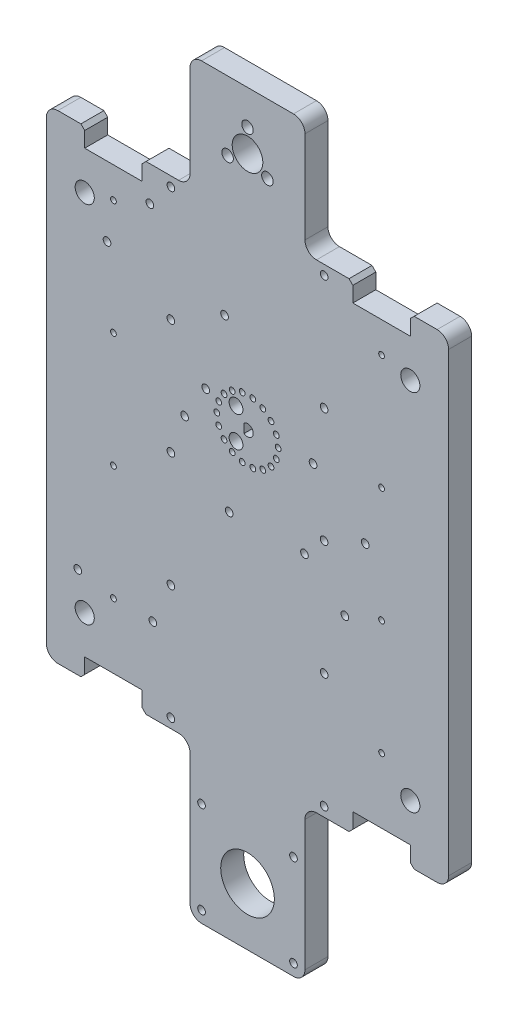
from build123d import *

# Parameters (mm, degrees)
SKETCH_1_W          = 105
SKETCH_1_H          = 125
EXTRUDE_1_DEPTH     = 6
CUT_EXTRUDE_1_REACH = 165.359
SKETCH_2_R          = 1
SKETCH_2_R_2        = 0.75
FILLET_1_R          = 3
CUT_EXTRUDE_2_REACH = 165.359
SKETCH_3_R          = 0.75
SKETCH_3_R_2        = 1.8
CUT_EXTRUDE1_REACH  = 165.359
SKETCH2_R           = 1
BOSS_EXTRUDE1_DEPTH = 6
CUT_EXTRUDE2_REACH  = 197.668
SKETCH5_R           = 4
SKETCH5_R_2         = 1.5
FILLET1_R           = 3
CUT_EXTRUDE3_REACH  = 197.668
SKETCH6_R           = 2.5
CUT_EXTRUDE4_REACH  = 197.668
SKETCH8_R           = 1
SKETCH8_R_2         = 7
FILLET2_R           = 3
SKETCH9_W           = 15
SKETCH9_H           = 6
CUT_EXTRUDE5_DEPTH  = 5
SKETCH10_W          = 15
SKETCH10_H          = 6
CUT_EXTRUDE6_DEPTH  = 5
CHAMFER1_SIZE       = 1


with BuildPart() as part:
    # 草图1 → 凸台-拉伸1 (new body)
    with BuildSketch(Plane.XY):
        with Locations((52.5, -62.5)):
            Rectangle(SKETCH_1_W, SKETCH_1_H)
    extrude(amount=EXTRUDE_1_DEPTH)

    # 草图2 → 切除-拉伸1 (cut, up to next)
    with BuildSketch(Plane.XY.offset(6), mode=Mode.PRIVATE) as cut_extrude_1_sk1:
        with Locations((32.5, -2.5)):
            Circle(SKETCH_2_R)
    cut_extrude_1_tool1 = extrude(cut_extrude_1_sk1.sketch, amount=-CUT_EXTRUDE_1_REACH, mode=Mode.PRIVATE) & part.part
    # 草图2 → 切除-拉伸1 (cut, up to next)
    with BuildSketch(Plane.XY.offset(6), mode=Mode.PRIVATE) as cut_extrude_1_sk2:
        with Locations((72.5, -2.5)):
            Circle(SKETCH_2_R)
    cut_extrude_1_tool2 = extrude(cut_extrude_1_sk2.sketch, amount=-CUT_EXTRUDE_1_REACH, mode=Mode.PRIVATE) & part.part
    # 草图2 → 切除-拉伸1 (cut, up to next)
    with BuildSketch(Plane.XY.offset(6), mode=Mode.PRIVATE) as cut_extrude_1_sk3:
        with Locations((72.5, -32.5)):
            Circle(SKETCH_2_R)
    cut_extrude_1_tool3 = extrude(cut_extrude_1_sk3.sketch, amount=-CUT_EXTRUDE_1_REACH, mode=Mode.PRIVATE) & part.part
    # 草图2 → 切除-拉伸1 (cut, up to next)
    with BuildSketch(Plane.XY.offset(6), mode=Mode.PRIVATE) as cut_extrude_1_sk4:
        with Locations((72.5, -62.5)):
            Circle(SKETCH_2_R)
    cut_extrude_1_tool4 = extrude(cut_extrude_1_sk4.sketch, amount=-CUT_EXTRUDE_1_REACH, mode=Mode.PRIVATE) & part.part
    # 草图2 → 切除-拉伸1 (cut, up to next)
    with BuildSketch(Plane.XY.offset(6), mode=Mode.PRIVATE) as cut_extrude_1_sk5:
        with Locations((72.5, -92.5)):
            Circle(SKETCH_2_R)
    cut_extrude_1_tool5 = extrude(cut_extrude_1_sk5.sketch, amount=-CUT_EXTRUDE_1_REACH, mode=Mode.PRIVATE) & part.part
    # 草图2 → 切除-拉伸1 (cut, up to next)
    with BuildSketch(Plane.XY.offset(6), mode=Mode.PRIVATE) as cut_extrude_1_sk6:
        with Locations((72.5, -122.5)):
            Circle(SKETCH_2_R)
    cut_extrude_1_tool6 = extrude(cut_extrude_1_sk6.sketch, amount=-CUT_EXTRUDE_1_REACH, mode=Mode.PRIVATE) & part.part
    # 草图2 → 切除-拉伸1 (cut, up to next)
    with BuildSketch(Plane.XY.offset(6), mode=Mode.PRIVATE) as cut_extrude_1_sk7:
        with Locations((32.5, -32.5)):
            Circle(SKETCH_2_R)
    cut_extrude_1_tool7 = extrude(cut_extrude_1_sk7.sketch, amount=-CUT_EXTRUDE_1_REACH, mode=Mode.PRIVATE) & part.part
    # 草图2 → 切除-拉伸1 (cut, up to next)
    with BuildSketch(Plane.XY.offset(6), mode=Mode.PRIVATE) as cut_extrude_1_sk8:
        with Locations((32.5, -62.5)):
            Circle(SKETCH_2_R)
    cut_extrude_1_tool8 = extrude(cut_extrude_1_sk8.sketch, amount=-CUT_EXTRUDE_1_REACH, mode=Mode.PRIVATE) & part.part
    # 草图2 → 切除-拉伸1 (cut, up to next)
    with BuildSketch(Plane.XY.offset(6), mode=Mode.PRIVATE) as cut_extrude_1_sk9:
        with Locations((32.5, -92.5)):
            Circle(SKETCH_2_R)
    cut_extrude_1_tool9 = extrude(cut_extrude_1_sk9.sketch, amount=-CUT_EXTRUDE_1_REACH, mode=Mode.PRIVATE) & part.part
    # 草图2 → 切除-拉伸1 (cut, up to next)
    with BuildSketch(Plane.XY.offset(6), mode=Mode.PRIVATE) as cut_extrude_1_sk10:
        with Locations((32.5, -122.5)):
            Circle(SKETCH_2_R)
    cut_extrude_1_tool10 = extrude(cut_extrude_1_sk10.sketch, amount=-CUT_EXTRUDE_1_REACH, mode=Mode.PRIVATE) & part.part
    # 草图2 → 切除-拉伸1 (cut, up to next)
    with BuildSketch(Plane.XY.offset(6), mode=Mode.PRIVATE) as cut_extrude_1_sk11:
        with Locations((17.5, -13)):
            Circle(SKETCH_2_R_2)
    cut_extrude_1_tool11 = extrude(cut_extrude_1_sk11.sketch, amount=-CUT_EXTRUDE_1_REACH, mode=Mode.PRIVATE) & part.part
    # 草图2 → 切除-拉伸1 (cut, up to next)
    with BuildSketch(Plane.XY.offset(6), mode=Mode.PRIVATE) as cut_extrude_1_sk12:
        with Locations((87.5, -13)):
            Circle(SKETCH_2_R_2)
    cut_extrude_1_tool12 = extrude(cut_extrude_1_sk12.sketch, amount=-CUT_EXTRUDE_1_REACH, mode=Mode.PRIVATE) & part.part
    # 草图2 → 切除-拉伸1 (cut, up to next)
    with BuildSketch(Plane.XY.offset(6), mode=Mode.PRIVATE) as cut_extrude_1_sk13:
        with Locations((87.5, -43)):
            Circle(SKETCH_2_R_2)
    cut_extrude_1_tool13 = extrude(cut_extrude_1_sk13.sketch, amount=-CUT_EXTRUDE_1_REACH, mode=Mode.PRIVATE) & part.part
    # 草图2 → 切除-拉伸1 (cut, up to next)
    with BuildSketch(Plane.XY.offset(6), mode=Mode.PRIVATE) as cut_extrude_1_sk14:
        with Locations((87.5, -73)):
            Circle(SKETCH_2_R_2)
    cut_extrude_1_tool14 = extrude(cut_extrude_1_sk14.sketch, amount=-CUT_EXTRUDE_1_REACH, mode=Mode.PRIVATE) & part.part
    # 草图2 → 切除-拉伸1 (cut, up to next)
    with BuildSketch(Plane.XY.offset(6), mode=Mode.PRIVATE) as cut_extrude_1_sk15:
        with Locations((87.5, -103)):
            Circle(SKETCH_2_R_2)
    cut_extrude_1_tool15 = extrude(cut_extrude_1_sk15.sketch, amount=-CUT_EXTRUDE_1_REACH, mode=Mode.PRIVATE) & part.part
    # 草图2 → 切除-拉伸1 (cut, up to next)
    with BuildSketch(Plane.XY.offset(6), mode=Mode.PRIVATE) as cut_extrude_1_sk16:
        with Locations((17.5, -43)):
            Circle(SKETCH_2_R_2)
    cut_extrude_1_tool16 = extrude(cut_extrude_1_sk16.sketch, amount=-CUT_EXTRUDE_1_REACH, mode=Mode.PRIVATE) & part.part
    # 草图2 → 切除-拉伸1 (cut, up to next)
    with BuildSketch(Plane.XY.offset(6), mode=Mode.PRIVATE) as cut_extrude_1_sk17:
        with Locations((17.5, -73)):
            Circle(SKETCH_2_R_2)
    cut_extrude_1_tool17 = extrude(cut_extrude_1_sk17.sketch, amount=-CUT_EXTRUDE_1_REACH, mode=Mode.PRIVATE) & part.part
    # 草图2 → 切除-拉伸1 (cut, up to next)
    with BuildSketch(Plane.XY.offset(6), mode=Mode.PRIVATE) as cut_extrude_1_sk18:
        with Locations((17.5, -103)):
            Circle(SKETCH_2_R_2)
    cut_extrude_1_tool18 = extrude(cut_extrude_1_sk18.sketch, amount=-CUT_EXTRUDE_1_REACH, mode=Mode.PRIVATE) & part.part
    add(cut_extrude_1_tool1.solids().sort_by_distance((32.5, -2.5, 6))[0], mode=Mode.SUBTRACT)
    add(cut_extrude_1_tool2.solids().sort_by_distance((72.5, -2.5, 6))[0], mode=Mode.SUBTRACT)
    add(cut_extrude_1_tool3.solids().sort_by_distance((72.5, -32.5, 6))[0], mode=Mode.SUBTRACT)
    add(cut_extrude_1_tool4.solids().sort_by_distance((72.5, -62.5, 6))[0], mode=Mode.SUBTRACT)
    add(cut_extrude_1_tool5.solids().sort_by_distance((72.5, -92.5, 6))[0], mode=Mode.SUBTRACT)
    add(cut_extrude_1_tool6.solids().sort_by_distance((72.5, -122.5, 6))[0], mode=Mode.SUBTRACT)
    add(cut_extrude_1_tool7.solids().sort_by_distance((32.5, -32.5, 6))[0], mode=Mode.SUBTRACT)
    add(cut_extrude_1_tool8.solids().sort_by_distance((32.5, -62.5, 6))[0], mode=Mode.SUBTRACT)
    add(cut_extrude_1_tool9.solids().sort_by_distance((32.5, -92.5, 6))[0], mode=Mode.SUBTRACT)
    add(cut_extrude_1_tool10.solids().sort_by_distance((32.5, -122.5, 6))[0], mode=Mode.SUBTRACT)
    add(cut_extrude_1_tool11.solids().sort_by_distance((17.5, -13, 6))[0], mode=Mode.SUBTRACT)
    add(cut_extrude_1_tool12.solids().sort_by_distance((87.5, -13, 6))[0], mode=Mode.SUBTRACT)
    add(cut_extrude_1_tool13.solids().sort_by_distance((87.5, -43, 6))[0], mode=Mode.SUBTRACT)
    add(cut_extrude_1_tool14.solids().sort_by_distance((87.5, -73, 6))[0], mode=Mode.SUBTRACT)
    add(cut_extrude_1_tool15.solids().sort_by_distance((87.5, -103, 6))[0], mode=Mode.SUBTRACT)
    add(cut_extrude_1_tool16.solids().sort_by_distance((17.5, -43, 6))[0], mode=Mode.SUBTRACT)
    add(cut_extrude_1_tool17.solids().sort_by_distance((17.5, -73, 6))[0], mode=Mode.SUBTRACT)
    add(cut_extrude_1_tool18.solids().sort_by_distance((17.5, -103, 6))[0], mode=Mode.SUBTRACT)

    # 圆角1
    fillet_1_edges = [part.edges().sort_by_distance(p)[0] for p in [
        (0, 0, 3),
        (105, 0, 3),
        (105, -125, 3),
        (0, -125, 3),
    ]]
    fillet(fillet_1_edges, radius=FILLET_1_R)

    # 草图3 → 切除-拉伸2 (cut, up to next)
    with BuildSketch(Plane.XY.offset(6), mode=Mode.PRIVATE) as cut_extrude_2_sk1:
        with Locations((44.5, -47.5)):
            Circle(SKETCH_3_R)
    cut_extrude_2_tool1 = extrude(cut_extrude_2_sk1.sketch, amount=-CUT_EXTRUDE_2_REACH, mode=Mode.PRIVATE) & part.part
    # 草图3 → 切除-拉伸2 (cut, up to next)
    with BuildSketch(Plane.XY.offset(6), mode=Mode.PRIVATE) as cut_extrude_2_sk2:
        with Locations((44.982459034, -44.763838853)):
            Circle(SKETCH_3_R)
    cut_extrude_2_tool2 = extrude(cut_extrude_2_sk2.sketch, amount=-CUT_EXTRUDE_2_REACH, mode=Mode.PRIVATE) & part.part
    # 草图3 → 切除-拉伸2 (cut, up to next)
    with BuildSketch(Plane.XY.offset(6), mode=Mode.PRIVATE) as cut_extrude_2_sk3:
        with Locations((49.5, -43.5)):
            Circle(SKETCH_3_R_2)
    cut_extrude_2_tool3 = extrude(cut_extrude_2_sk3.sketch, amount=-CUT_EXTRUDE_2_REACH, mode=Mode.PRIVATE) & part.part
    # 草图3 → 切除-拉伸2 (cut, up to next)
    with BuildSketch(Plane.XY.offset(6), mode=Mode.PRIVATE) as cut_extrude_2_sk4:
        with Locations((49.5, -51.5)):
            Circle(SKETCH_3_R_2)
    cut_extrude_2_tool4 = extrude(cut_extrude_2_sk4.sketch, amount=-CUT_EXTRUDE_2_REACH, mode=Mode.PRIVATE) & part.part
    # 草图3 → 切除-拉伸2 (cut, up to next)
    with BuildSketch(Plane.XY.offset(6), mode=Mode.PRIVATE) as cut_extrude_2_sk5:
        with Locations((46.371644455, -42.357699123)):
            Circle(SKETCH_3_R)
    cut_extrude_2_tool5 = extrude(cut_extrude_2_sk5.sketch, amount=-CUT_EXTRUDE_2_REACH, mode=Mode.PRIVATE) & part.part
    # 草图3 → 切除-拉伸2 (cut, up to next)
    with BuildSketch(Plane.XY.offset(6), mode=Mode.PRIVATE) as cut_extrude_2_sk6:
        with Locations((48.5, -40.57179677)):
            Circle(SKETCH_3_R)
    cut_extrude_2_tool6 = extrude(cut_extrude_2_sk6.sketch, amount=-CUT_EXTRUDE_2_REACH, mode=Mode.PRIVATE) & part.part
    # 草图3 → 切除-拉伸2 (cut, up to next)
    with BuildSketch(Plane.XY.offset(6), mode=Mode.PRIVATE) as cut_extrude_2_sk7:
        with Locations((51.110814579, -39.621537976)):
            Circle(SKETCH_3_R)
    cut_extrude_2_tool7 = extrude(cut_extrude_2_sk7.sketch, amount=-CUT_EXTRUDE_2_REACH, mode=Mode.PRIVATE) & part.part
    # 草图3 → 切除-拉伸2 (cut, up to next)
    with BuildSketch(Plane.XY.offset(6), mode=Mode.PRIVATE) as cut_extrude_2_sk8:
        with Locations((53.889185421, -39.621537976)):
            Circle(SKETCH_3_R)
    cut_extrude_2_tool8 = extrude(cut_extrude_2_sk8.sketch, amount=-CUT_EXTRUDE_2_REACH, mode=Mode.PRIVATE) & part.part
    # 草图3 → 切除-拉伸2 (cut, up to next)
    with BuildSketch(Plane.XY.offset(6), mode=Mode.PRIVATE) as cut_extrude_2_sk9:
        with Locations((56.5, -40.57179677)):
            Circle(SKETCH_3_R)
    cut_extrude_2_tool9 = extrude(cut_extrude_2_sk9.sketch, amount=-CUT_EXTRUDE_2_REACH, mode=Mode.PRIVATE) & part.part
    # 草图3 → 切除-拉伸2 (cut, up to next)
    with BuildSketch(Plane.XY.offset(6), mode=Mode.PRIVATE) as cut_extrude_2_sk10:
        with Locations((58.628355545, -42.357699123)):
            Circle(SKETCH_3_R)
    cut_extrude_2_tool10 = extrude(cut_extrude_2_sk10.sketch, amount=-CUT_EXTRUDE_2_REACH, mode=Mode.PRIVATE) & part.part
    # 草图3 → 切除-拉伸2 (cut, up to next)
    with BuildSketch(Plane.XY.offset(6), mode=Mode.PRIVATE) as cut_extrude_2_sk11:
        with Locations((60.017540966, -44.763838853)):
            Circle(SKETCH_3_R)
    cut_extrude_2_tool11 = extrude(cut_extrude_2_sk11.sketch, amount=-CUT_EXTRUDE_2_REACH, mode=Mode.PRIVATE) & part.part
    # 草图3 → 切除-拉伸2 (cut, up to next)
    with BuildSketch(Plane.XY.offset(6), mode=Mode.PRIVATE) as cut_extrude_2_sk12:
        with Locations((60.5, -47.5)):
            Circle(SKETCH_3_R)
    cut_extrude_2_tool12 = extrude(cut_extrude_2_sk12.sketch, amount=-CUT_EXTRUDE_2_REACH, mode=Mode.PRIVATE) & part.part
    # 草图3 → 切除-拉伸2 (cut, up to next)
    with BuildSketch(Plane.XY.offset(6), mode=Mode.PRIVATE) as cut_extrude_2_sk13:
        with Locations((60.017540966, -50.236161147)):
            Circle(SKETCH_3_R)
    cut_extrude_2_tool13 = extrude(cut_extrude_2_sk13.sketch, amount=-CUT_EXTRUDE_2_REACH, mode=Mode.PRIVATE) & part.part
    # 草图3 → 切除-拉伸2 (cut, up to next)
    with BuildSketch(Plane.XY.offset(6), mode=Mode.PRIVATE) as cut_extrude_2_sk14:
        with Locations((58.628355545, -52.642300877)):
            Circle(SKETCH_3_R)
    cut_extrude_2_tool14 = extrude(cut_extrude_2_sk14.sketch, amount=-CUT_EXTRUDE_2_REACH, mode=Mode.PRIVATE) & part.part
    # 草图3 → 切除-拉伸2 (cut, up to next)
    with BuildSketch(Plane.XY.offset(6), mode=Mode.PRIVATE) as cut_extrude_2_sk15:
        with Locations((56.5, -54.42820323)):
            Circle(SKETCH_3_R)
    cut_extrude_2_tool15 = extrude(cut_extrude_2_sk15.sketch, amount=-CUT_EXTRUDE_2_REACH, mode=Mode.PRIVATE) & part.part
    # 草图3 → 切除-拉伸2 (cut, up to next)
    with BuildSketch(Plane.XY.offset(6), mode=Mode.PRIVATE) as cut_extrude_2_sk16:
        with Locations((53.889185421, -55.378462024)):
            Circle(SKETCH_3_R)
    cut_extrude_2_tool16 = extrude(cut_extrude_2_sk16.sketch, amount=-CUT_EXTRUDE_2_REACH, mode=Mode.PRIVATE) & part.part
    # 草图3 → 切除-拉伸2 (cut, up to next)
    with BuildSketch(Plane.XY.offset(6), mode=Mode.PRIVATE) as cut_extrude_2_sk17:
        with Locations((51.110814579, -55.378462024)):
            Circle(SKETCH_3_R)
    cut_extrude_2_tool17 = extrude(cut_extrude_2_sk17.sketch, amount=-CUT_EXTRUDE_2_REACH, mode=Mode.PRIVATE) & part.part
    # 草图3 → 切除-拉伸2 (cut, up to next)
    with BuildSketch(Plane.XY.offset(6), mode=Mode.PRIVATE) as cut_extrude_2_sk18:
        with Locations((48.5, -54.42820323)):
            Circle(SKETCH_3_R)
    cut_extrude_2_tool18 = extrude(cut_extrude_2_sk18.sketch, amount=-CUT_EXTRUDE_2_REACH, mode=Mode.PRIVATE) & part.part
    # 草图3 → 切除-拉伸2 (cut, up to next)
    with BuildSketch(Plane.XY.offset(6), mode=Mode.PRIVATE) as cut_extrude_2_sk19:
        with Locations((46.371644455, -52.642300877)):
            Circle(SKETCH_3_R)
    cut_extrude_2_tool19 = extrude(cut_extrude_2_sk19.sketch, amount=-CUT_EXTRUDE_2_REACH, mode=Mode.PRIVATE) & part.part
    # 草图3 → 切除-拉伸2 (cut, up to next)
    with BuildSketch(Plane.XY.offset(6), mode=Mode.PRIVATE) as cut_extrude_2_sk20:
        with Locations((44.982459034, -50.236161147)):
            Circle(SKETCH_3_R)
    cut_extrude_2_tool20 = extrude(cut_extrude_2_sk20.sketch, amount=-CUT_EXTRUDE_2_REACH, mode=Mode.PRIVATE) & part.part
    # 草图3 → 切除-拉伸2 (cut, up to next)
    with BuildSketch(Plane.XY.offset(6), mode=Mode.PRIVATE) as cut_extrude_2_sk21:
        with BuildLine():
            Line((51.6, -46.3), (51.6, -48.7))
            ThreePointArc((51.6, -48.7), (54, -47.5), (51.6, -46.3))
        make_face()
    cut_extrude_2_tool21 = extrude(cut_extrude_2_sk21.sketch, amount=-CUT_EXTRUDE_2_REACH, mode=Mode.PRIVATE) & part.part
    add(cut_extrude_2_tool1.solids().sort_by_distance((44.5, -47.5, 6))[0], mode=Mode.SUBTRACT)
    add(cut_extrude_2_tool2.solids().sort_by_distance((44.982459, -44.763839, 6))[0], mode=Mode.SUBTRACT)
    add(cut_extrude_2_tool3.solids().sort_by_distance((49.5, -43.5, 6))[0], mode=Mode.SUBTRACT)
    add(cut_extrude_2_tool4.solids().sort_by_distance((49.5, -51.5, 6))[0], mode=Mode.SUBTRACT)
    add(cut_extrude_2_tool5.solids().sort_by_distance((46.371644, -42.357699, 6))[0], mode=Mode.SUBTRACT)
    add(cut_extrude_2_tool6.solids().sort_by_distance((48.5, -40.571797, 6))[0], mode=Mode.SUBTRACT)
    add(cut_extrude_2_tool7.solids().sort_by_distance((51.110815, -39.621538, 6))[0], mode=Mode.SUBTRACT)
    add(cut_extrude_2_tool8.solids().sort_by_distance((53.889185, -39.621538, 6))[0], mode=Mode.SUBTRACT)
    add(cut_extrude_2_tool9.solids().sort_by_distance((56.5, -40.571797, 6))[0], mode=Mode.SUBTRACT)
    add(cut_extrude_2_tool10.solids().sort_by_distance((58.628356, -42.357699, 6))[0], mode=Mode.SUBTRACT)
    add(cut_extrude_2_tool11.solids().sort_by_distance((60.017541, -44.763839, 6))[0], mode=Mode.SUBTRACT)
    add(cut_extrude_2_tool12.solids().sort_by_distance((60.5, -47.5, 6))[0], mode=Mode.SUBTRACT)
    add(cut_extrude_2_tool13.solids().sort_by_distance((60.017541, -50.236161, 6))[0], mode=Mode.SUBTRACT)
    add(cut_extrude_2_tool14.solids().sort_by_distance((58.628356, -52.642301, 6))[0], mode=Mode.SUBTRACT)
    add(cut_extrude_2_tool15.solids().sort_by_distance((56.5, -54.428203, 6))[0], mode=Mode.SUBTRACT)
    add(cut_extrude_2_tool16.solids().sort_by_distance((53.889185, -55.378462, 6))[0], mode=Mode.SUBTRACT)
    add(cut_extrude_2_tool17.solids().sort_by_distance((51.110815, -55.378462, 6))[0], mode=Mode.SUBTRACT)
    add(cut_extrude_2_tool18.solids().sort_by_distance((48.5, -54.428203, 6))[0], mode=Mode.SUBTRACT)
    add(cut_extrude_2_tool19.solids().sort_by_distance((46.371644, -52.642301, 6))[0], mode=Mode.SUBTRACT)
    add(cut_extrude_2_tool20.solids().sort_by_distance((44.982459, -50.236161, 6))[0], mode=Mode.SUBTRACT)
    add(cut_extrude_2_tool21.solids().sort_by_distance((52.690031, -47.5, 6))[0], mode=Mode.SUBTRACT)

    # Sketch2 → Cut-Extrude1 (cut, up to next)
    with BuildSketch(Plane(origin=(0, 0, 0), x_dir=(-1, 0, 0), z_dir=(0, 0, -1)), mode=Mode.PRIVATE) as cut_extrude1_sk1:
        with Locations((-27.007493333, -9.049358214)):
            Circle(SKETCH2_R)
    cut_extrude1_tool1 = extrude(cut_extrude1_sk1.sketch, amount=-CUT_EXTRUDE1_REACH, mode=Mode.PRIVATE) & part.part
    # Sketch2 → Cut-Extrude1 (cut, up to next)
    with BuildSketch(Plane(origin=(0, 0, 0), x_dir=(-1, 0, 0), z_dir=(0, 0, -1)), mode=Mode.PRIVATE) as cut_extrude1_sk2:
        with Locations((-15.831491831, -23.159531509)):
            Circle(SKETCH2_R)
    cut_extrude1_tool2 = extrude(cut_extrude1_sk2.sketch, amount=-CUT_EXTRUDE1_REACH, mode=Mode.PRIVATE) & part.part
    # Sketch2 → Cut-Extrude1 (cut, up to next)
    with BuildSketch(Plane(origin=(0, 0, 0), x_dir=(-1, 0, 0), z_dir=(0, 0, -1)), mode=Mode.PRIVATE) as cut_extrude1_sk3:
        with Locations((-41.603321246, -43.572179762)):
            Circle(SKETCH2_R)
    cut_extrude1_tool3 = extrude(cut_extrude1_sk3.sketch, amount=-CUT_EXTRUDE1_REACH, mode=Mode.PRIVATE) & part.part
    # Sketch2 → Cut-Extrude1 (cut, up to next)
    with BuildSketch(Plane(origin=(0, 0, 0), x_dir=(-1, 0, 0), z_dir=(0, 0, -1)), mode=Mode.PRIVATE) as cut_extrude1_sk4:
        with Locations((-27.794694634, -103.138789015)):
            Circle(SKETCH2_R)
    cut_extrude1_tool4 = extrude(cut_extrude1_sk4.sketch, amount=-CUT_EXTRUDE1_REACH, mode=Mode.PRIVATE) & part.part
    # Sketch2 → Cut-Extrude1 (cut, up to next)
    with BuildSketch(Plane(origin=(0, 0, 0), x_dir=(-1, 0, 0), z_dir=(0, 0, -1)), mode=Mode.PRIVATE) as cut_extrude1_sk5:
        with Locations((-36.076949821, -52.503511863)):
            Circle(SKETCH2_R)
    cut_extrude1_tool5 = extrude(cut_extrude1_sk5.sketch, amount=-CUT_EXTRUDE1_REACH, mode=Mode.PRIVATE) & part.part
    # Sketch2 → Cut-Extrude1 (cut, up to next)
    with BuildSketch(Plane(origin=(0, 0, 0), x_dir=(-1, 0, 0), z_dir=(0, 0, -1)), mode=Mode.PRIVATE) as cut_extrude1_sk6:
        with Locations((-77.908324015, -76.741624219)):
            Circle(SKETCH2_R)
    cut_extrude1_tool6 = extrude(cut_extrude1_sk6.sketch, amount=-CUT_EXTRUDE1_REACH, mode=Mode.PRIVATE) & part.part
    # Sketch2 → Cut-Extrude1 (cut, up to next)
    with BuildSketch(Plane(origin=(0, 0, 0), x_dir=(-1, 0, 0), z_dir=(0, 0, -1)), mode=Mode.PRIVATE) as cut_extrude1_sk7:
        with Locations((-69.609216951, -46.494536927)):
            Circle(SKETCH2_R)
    cut_extrude1_tool7 = extrude(cut_extrude1_sk7.sketch, amount=-CUT_EXTRUDE1_REACH, mode=Mode.PRIVATE) & part.part
    # Sketch2 → Cut-Extrude1 (cut, up to next)
    with BuildSketch(Plane(origin=(0, 0, 0), x_dir=(-1, 0, 0), z_dir=(0, 0, -1)), mode=Mode.PRIVATE) as cut_extrude1_sk8:
        with Locations((-46.508134617, -24.494894688)):
            Circle(SKETCH2_R)
    cut_extrude1_tool8 = extrude(cut_extrude1_sk8.sketch, amount=-CUT_EXTRUDE1_REACH, mode=Mode.PRIVATE) & part.part
    # Sketch2 → Cut-Extrude1 (cut, up to next)
    with BuildSketch(Plane(origin=(0, 0, 0), x_dir=(-1, 0, 0), z_dir=(0, 0, -1)), mode=Mode.PRIVATE) as cut_extrude1_sk9:
        with Locations((-8.200070919, -101.126148596)):
            Circle(SKETCH2_R)
    cut_extrude1_tool9 = extrude(cut_extrude1_sk9.sketch, amount=-CUT_EXTRUDE1_REACH, mode=Mode.PRIVATE) & part.part
    # Sketch2 → Cut-Extrude1 (cut, up to next)
    with BuildSketch(Plane(origin=(0, 0, 0), x_dir=(-1, 0, 0), z_dir=(0, 0, -1)), mode=Mode.PRIVATE) as cut_extrude1_sk10:
        with Locations((-47.713449113, -68.396651396)):
            Circle(SKETCH2_R)
    cut_extrude1_tool10 = extrude(cut_extrude1_sk10.sketch, amount=-CUT_EXTRUDE1_REACH, mode=Mode.PRIVATE) & part.part
    # Sketch2 → Cut-Extrude1 (cut, up to next)
    with BuildSketch(Plane(origin=(0, 0, 0), x_dir=(-1, 0, 0), z_dir=(0, 0, -1)), mode=Mode.PRIVATE) as cut_extrude1_sk11:
        with Locations((-67.368562658, -68.01149462)):
            Circle(SKETCH2_R)
    cut_extrude1_tool11 = extrude(cut_extrude1_sk11.sketch, amount=-CUT_EXTRUDE1_REACH, mode=Mode.PRIVATE) & part.part
    # Sketch2 → Cut-Extrude1 (cut, up to next)
    with BuildSketch(Plane(origin=(0, 0, 0), x_dir=(-1, 0, 0), z_dir=(0, 0, -1)), mode=Mode.PRIVATE) as cut_extrude1_sk12:
        with Locations((-83.229468795, -57.776250028)):
            Circle(SKETCH2_R)
    cut_extrude1_tool12 = extrude(cut_extrude1_sk12.sketch, amount=-CUT_EXTRUDE1_REACH, mode=Mode.PRIVATE) & part.part
    add(cut_extrude1_tool1.solids().sort_by_distance((27.007493, -9.049358, 0))[0], mode=Mode.SUBTRACT)
    add(cut_extrude1_tool2.solids().sort_by_distance((15.831492, -23.159532, 0))[0], mode=Mode.SUBTRACT)
    add(cut_extrude1_tool3.solids().sort_by_distance((41.603321, -43.57218, 0))[0], mode=Mode.SUBTRACT)
    add(cut_extrude1_tool4.solids().sort_by_distance((27.794695, -103.138789, 0))[0], mode=Mode.SUBTRACT)
    add(cut_extrude1_tool5.solids().sort_by_distance((36.07695, -52.503512, 0))[0], mode=Mode.SUBTRACT)
    add(cut_extrude1_tool6.solids().sort_by_distance((77.908324, -76.741624, 0))[0], mode=Mode.SUBTRACT)
    add(cut_extrude1_tool7.solids().sort_by_distance((69.609217, -46.494537, 0))[0], mode=Mode.SUBTRACT)
    add(cut_extrude1_tool8.solids().sort_by_distance((46.508135, -24.494895, 0))[0], mode=Mode.SUBTRACT)
    add(cut_extrude1_tool9.solids().sort_by_distance((8.200071, -101.126149, 0))[0], mode=Mode.SUBTRACT)
    add(cut_extrude1_tool10.solids().sort_by_distance((47.713449, -68.396651, 0))[0], mode=Mode.SUBTRACT)
    add(cut_extrude1_tool11.solids().sort_by_distance((67.368563, -68.011495, 0))[0], mode=Mode.SUBTRACT)
    add(cut_extrude1_tool12.solids().sort_by_distance((83.229469, -57.77625, 0))[0], mode=Mode.SUBTRACT)

    # Sketch3 → Boss-Extrude1 (add)
    with BuildSketch(Plane(origin=(0, 0, 0), x_dir=(-1, 0, 0), z_dir=(0, 0, -1))):
        Polygon((-52.5, -125), (-37.5, -125), (-37.5, -165), (-67.5, -165), (-67.5, -125), align=None)
        Polygon((-52.5, 0), (-37.5, 0), (-37.5, 30), (-67.5, 30), (-67.5, 0), align=None)
    extrude(amount=-BOSS_EXTRUDE1_DEPTH)

    # Sketch5 → Cut-Extrude2 (cut, up to next)
    with BuildSketch(Plane(origin=(0, 0, 0), x_dir=(-1, 0, 0), z_dir=(0, 0, -1)), mode=Mode.PRIVATE) as cut_extrude2_sk1:
        with Locations((-52.5, 15)):
            Circle(SKETCH5_R)
    cut_extrude2_tool1 = extrude(cut_extrude2_sk1.sketch, amount=-CUT_EXTRUDE2_REACH, mode=Mode.PRIVATE) & part.part
    # Sketch5 → Cut-Extrude2 (cut, up to next)
    with BuildSketch(Plane(origin=(0, 0, 0), x_dir=(-1, 0, 0), z_dir=(0, 0, -1)), mode=Mode.PRIVATE) as cut_extrude2_sk2:
        with Locations((-52.5, 21)):
            Circle(SKETCH5_R_2)
    cut_extrude2_tool2 = extrude(cut_extrude2_sk2.sketch, amount=-CUT_EXTRUDE2_REACH, mode=Mode.PRIVATE) & part.part
    # Sketch5 → Cut-Extrude2 (cut, up to next)
    with BuildSketch(Plane(origin=(0, 0, 0), x_dir=(-1, 0, 0), z_dir=(0, 0, -1)), mode=Mode.PRIVATE) as cut_extrude2_sk3:
        with Locations((-47.303847577, 12)):
            Circle(SKETCH5_R_2)
    cut_extrude2_tool3 = extrude(cut_extrude2_sk3.sketch, amount=-CUT_EXTRUDE2_REACH, mode=Mode.PRIVATE) & part.part
    # Sketch5 → Cut-Extrude2 (cut, up to next)
    with BuildSketch(Plane(origin=(0, 0, 0), x_dir=(-1, 0, 0), z_dir=(0, 0, -1)), mode=Mode.PRIVATE) as cut_extrude2_sk4:
        with Locations((-57.696152423, 12)):
            Circle(SKETCH5_R_2)
    cut_extrude2_tool4 = extrude(cut_extrude2_sk4.sketch, amount=-CUT_EXTRUDE2_REACH, mode=Mode.PRIVATE) & part.part
    add(cut_extrude2_tool1.solids().sort_by_distance((52.5, 15, 0))[0], mode=Mode.SUBTRACT)
    add(cut_extrude2_tool2.solids().sort_by_distance((52.5, 21, 0))[0], mode=Mode.SUBTRACT)
    add(cut_extrude2_tool3.solids().sort_by_distance((47.303848, 12, 0))[0], mode=Mode.SUBTRACT)
    add(cut_extrude2_tool4.solids().sort_by_distance((57.696152, 12, 0))[0], mode=Mode.SUBTRACT)

    # Fillet1
    fillet1_edges = [part.edges().sort_by_distance(p)[0] for p in [
        (67.5, 0, 3),
        (67.5, 30, 3),
        (37.5, 30, 3),
        (37.5, 0, 3),
    ]]
    fillet(fillet1_edges, radius=FILLET1_R)

    # Sketch6 → Cut-Extrude3 (cut, up to next)
    with BuildSketch(Plane(origin=(0, 0, 0), x_dir=(-1, 0, 0), z_dir=(0, 0, -1)), mode=Mode.PRIVATE) as cut_extrude3_sk1:
        with Locations((-95, -15)):
            Circle(SKETCH6_R)
    cut_extrude3_tool1 = extrude(cut_extrude3_sk1.sketch, amount=-CUT_EXTRUDE3_REACH, mode=Mode.PRIVATE) & part.part
    # Sketch6 → Cut-Extrude3 (cut, up to next)
    with BuildSketch(Plane(origin=(0, 0, 0), x_dir=(-1, 0, 0), z_dir=(0, 0, -1)), mode=Mode.PRIVATE) as cut_extrude3_sk2:
        with Locations((-95, -110)):
            Circle(SKETCH6_R)
    cut_extrude3_tool2 = extrude(cut_extrude3_sk2.sketch, amount=-CUT_EXTRUDE3_REACH, mode=Mode.PRIVATE) & part.part
    # Sketch6 → Cut-Extrude3 (cut, up to next)
    with BuildSketch(Plane(origin=(0, 0, 0), x_dir=(-1, 0, 0), z_dir=(0, 0, -1)), mode=Mode.PRIVATE) as cut_extrude3_sk3:
        with Locations((-10, -15)):
            Circle(SKETCH6_R)
    cut_extrude3_tool3 = extrude(cut_extrude3_sk3.sketch, amount=-CUT_EXTRUDE3_REACH, mode=Mode.PRIVATE) & part.part
    # Sketch6 → Cut-Extrude3 (cut, up to next)
    with BuildSketch(Plane(origin=(0, 0, 0), x_dir=(-1, 0, 0), z_dir=(0, 0, -1)), mode=Mode.PRIVATE) as cut_extrude3_sk4:
        with Locations((-10, -110)):
            Circle(SKETCH6_R)
    cut_extrude3_tool4 = extrude(cut_extrude3_sk4.sketch, amount=-CUT_EXTRUDE3_REACH, mode=Mode.PRIVATE) & part.part
    add(cut_extrude3_tool1.solids().sort_by_distance((95, -15, 0))[0], mode=Mode.SUBTRACT)
    add(cut_extrude3_tool2.solids().sort_by_distance((95, -110, 0))[0], mode=Mode.SUBTRACT)
    add(cut_extrude3_tool3.solids().sort_by_distance((10, -15, 0))[0], mode=Mode.SUBTRACT)
    add(cut_extrude3_tool4.solids().sort_by_distance((10, -110, 0))[0], mode=Mode.SUBTRACT)

    # Sketch8 → Cut-Extrude4 (cut, up to next)
    with BuildSketch(Plane(origin=(0, 0, 0), x_dir=(-1, 0, 0), z_dir=(0, 0, -1)), mode=Mode.PRIVATE) as cut_extrude4_sk1:
        with Locations((-64.5, -162)):
            Circle(SKETCH8_R)
    cut_extrude4_tool1 = extrude(cut_extrude4_sk1.sketch, amount=-CUT_EXTRUDE4_REACH, mode=Mode.PRIVATE) & part.part
    # Sketch8 → Cut-Extrude4 (cut, up to next)
    with BuildSketch(Plane(origin=(0, 0, 0), x_dir=(-1, 0, 0), z_dir=(0, 0, -1)), mode=Mode.PRIVATE) as cut_extrude4_sk2:
        with Locations((-40.5, -162)):
            Circle(SKETCH8_R)
    cut_extrude4_tool2 = extrude(cut_extrude4_sk2.sketch, amount=-CUT_EXTRUDE4_REACH, mode=Mode.PRIVATE) & part.part
    # Sketch8 → Cut-Extrude4 (cut, up to next)
    with BuildSketch(Plane(origin=(0, 0, 0), x_dir=(-1, 0, 0), z_dir=(0, 0, -1)), mode=Mode.PRIVATE) as cut_extrude4_sk3:
        with Locations((-64.5, -138)):
            Circle(SKETCH8_R)
    cut_extrude4_tool3 = extrude(cut_extrude4_sk3.sketch, amount=-CUT_EXTRUDE4_REACH, mode=Mode.PRIVATE) & part.part
    # Sketch8 → Cut-Extrude4 (cut, up to next)
    with BuildSketch(Plane(origin=(0, 0, 0), x_dir=(-1, 0, 0), z_dir=(0, 0, -1)), mode=Mode.PRIVATE) as cut_extrude4_sk4:
        with Locations((-40.5, -138)):
            Circle(SKETCH8_R)
    cut_extrude4_tool4 = extrude(cut_extrude4_sk4.sketch, amount=-CUT_EXTRUDE4_REACH, mode=Mode.PRIVATE) & part.part
    # Sketch8 → Cut-Extrude4 (cut, up to next)
    with BuildSketch(Plane(origin=(0, 0, 0), x_dir=(-1, 0, 0), z_dir=(0, 0, -1)), mode=Mode.PRIVATE) as cut_extrude4_sk5:
        with Locations((-52.5, -150)):
            Circle(SKETCH8_R_2)
    cut_extrude4_tool5 = extrude(cut_extrude4_sk5.sketch, amount=-CUT_EXTRUDE4_REACH, mode=Mode.PRIVATE) & part.part
    add(cut_extrude4_tool1.solids().sort_by_distance((64.5, -162, 0))[0], mode=Mode.SUBTRACT)
    add(cut_extrude4_tool2.solids().sort_by_distance((40.5, -162, 0))[0], mode=Mode.SUBTRACT)
    add(cut_extrude4_tool3.solids().sort_by_distance((64.5, -138, 0))[0], mode=Mode.SUBTRACT)
    add(cut_extrude4_tool4.solids().sort_by_distance((40.5, -138, 0))[0], mode=Mode.SUBTRACT)
    add(cut_extrude4_tool5.solids().sort_by_distance((52.5, -150, 0))[0], mode=Mode.SUBTRACT)

    # Fillet2
    fillet2_edges = [part.edges().sort_by_distance(p)[0] for p in [
        (67.5, -125, 3),
        (37.5, -125, 3),
        (37.5, -165, 3),
        (67.5, -165, 3),
    ]]
    fillet(fillet2_edges, radius=FILLET2_R)

    # Sketch9 → Cut-Extrude5 (cut)
    with BuildSketch(Plane.XZ.offset(125)):
        with Locations((17.5, 3)):
            Rectangle(SKETCH9_W, SKETCH9_H)
        with Locations((87.5, 3)):
            Rectangle(SKETCH9_W, SKETCH9_H)
    extrude(amount=-CUT_EXTRUDE5_DEPTH, mode=Mode.SUBTRACT)

    # Sketch10 → Cut-Extrude6 (cut)
    with BuildSketch(Plane(origin=(0, 0, 0), x_dir=(1, 0, 0), z_dir=(0, 1, 0))):
        with Locations((17.5, -3)):
            Rectangle(SKETCH10_W, SKETCH10_H)
        with Locations((87.5, -3)):
            Rectangle(SKETCH10_W, SKETCH10_H)
    extrude(amount=-CUT_EXTRUDE6_DEPTH, mode=Mode.SUBTRACT)

    # Chamfer1
    chamfer1_edges = [part.edges().sort_by_distance(p)[0] for p in [
        (25, -125, 3),
        (10, -125, 3),
        (95, -125, 3),
        (80, -125, 3),
        (10, 0, 3),
        (25, 0, 3),
        (80, 0, 3),
        (95, 0, 3),
    ]]
    chamfer(chamfer1_edges, length=CHAMFER1_SIZE)


solid = part.part
